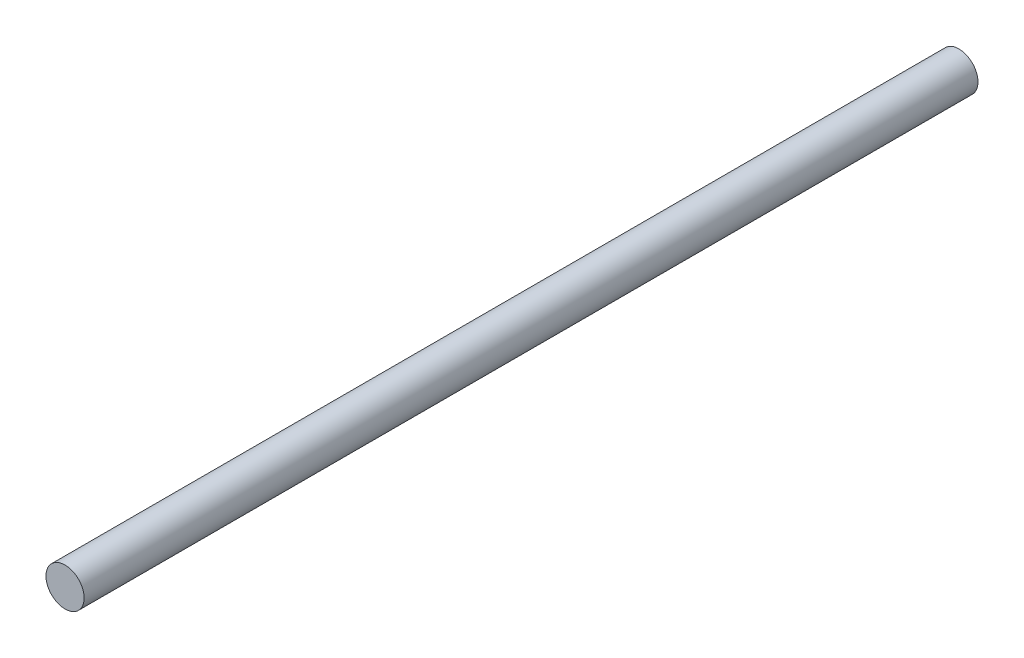
from build123d import *

# Parameters (mm, degrees)
SKETCH1_R           = 3.25
BOSS_EXTRUDE1_DEPTH = 152.24


with BuildPart() as part:
    # Sketch1 → Boss-Extrude1 (new body)
    with BuildSketch(Plane.XY):
        Circle(SKETCH1_R)
    extrude(amount=BOSS_EXTRUDE1_DEPTH)


solid = part.part
